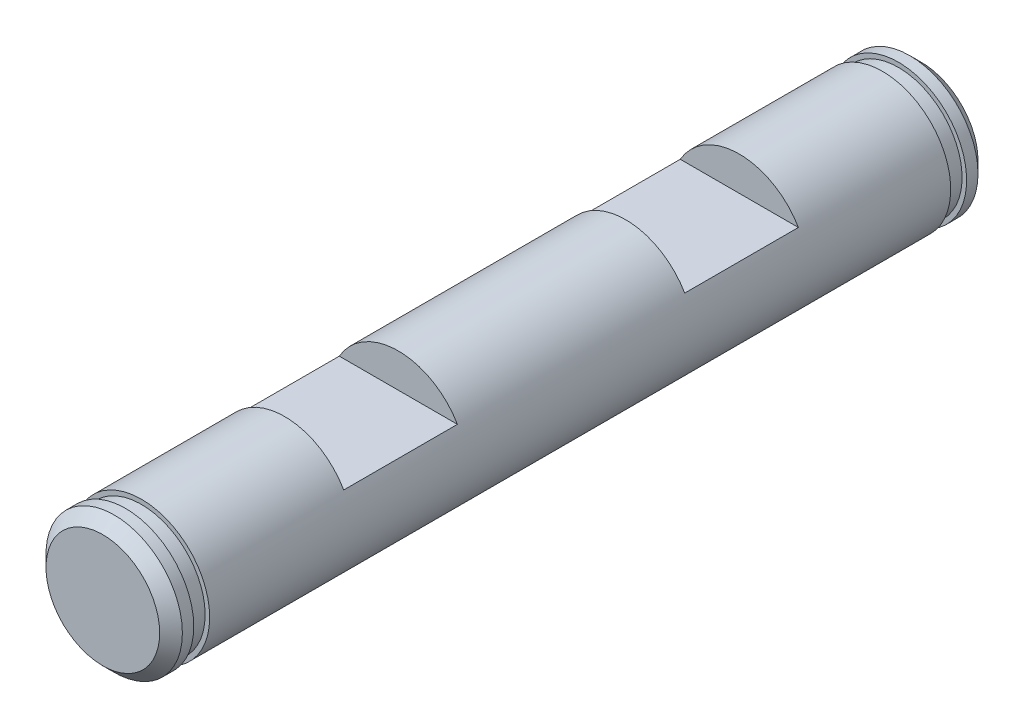
from build123d import *

# Parameters (mm, degrees)
SZKIC1_R                    = 3
DODANIE_WYCI_GNI_CIE1_DEPTH = 36
SFAZOWANIE1_SIZE            = 0.5
WYTNIJ_WYCI_GNI_CIE1_START  = -1.7
SZKIC2_R                    = 3
SZKIC2_R_2                  = 2.8
WYTNIJ_WYCI_GNI_CIE1_DEPTH  = 0.7
WYTNIJ_WYCI_GNI_CIE2_START  = -1
SZKIC3_R                    = 3
SZKIC3_R_2                  = 2.8
WYTNIJ_WYCI_GNI_CIE2_DEPTH  = 0.7
WYTNIJ_WYCI_GNI_CIE3_START  = -13
WYTNIJ_WYCI_GNI_CIE3_DEPTH  = 5
WYTNIJ_WYCI_GNI_CIE4_START  = -28
WYTNIJ_WYCI_GNI_CIE4_DEPTH  = 5


with BuildPart() as part:
    # Szkic1 → Dodanie-wyciągnięcie1 (new body)
    with BuildSketch(Plane.XY):
        Circle(SZKIC1_R)
    extrude(amount=DODANIE_WYCI_GNI_CIE1_DEPTH)

    # Sfazowanie1
    sfazowanie1_edges = [part.edges().sort_by_distance(p)[0] for p in [
        (-3, 0, 0),
        (-3, 0, 36),
    ]]
    chamfer(sfazowanie1_edges, length=SFAZOWANIE1_SIZE)

    # Szkic2 → Wytnij-wyciągnięcie1 (cut)
    with BuildSketch(Plane.XY.offset(36).offset(WYTNIJ_WYCI_GNI_CIE1_START)):
        Circle(SZKIC2_R)
        Circle(SZKIC2_R_2, mode=Mode.SUBTRACT)
    extrude(amount=WYTNIJ_WYCI_GNI_CIE1_DEPTH, mode=Mode.SUBTRACT)

    # Szkic3 → Wytnij-wyciągnięcie2 (cut)
    with BuildSketch(Plane(origin=(0, 0, 0), x_dir=(-1, 0, 0), z_dir=(0, 0, -1)).offset(WYTNIJ_WYCI_GNI_CIE2_START)):
        Circle(SZKIC3_R)
        Circle(SZKIC3_R_2, mode=Mode.SUBTRACT)
    extrude(amount=-WYTNIJ_WYCI_GNI_CIE2_DEPTH, mode=Mode.SUBTRACT)

    # Szkic4 → Wytnij-wyciągnięcie3 (cut)
    with BuildSketch(Plane.XY.offset(36).offset(WYTNIJ_WYCI_GNI_CIE3_START)):
        with BuildLine():
            Line((-2.598076211, 1.5), (2.598076211, 1.5))
            ThreePointArc((2.598076211, 1.5), (0, 3), (-2.598076211, 1.5))
        make_face()
    extrude(amount=WYTNIJ_WYCI_GNI_CIE3_DEPTH, mode=Mode.SUBTRACT)

    # Szkic4<2> → Wytnij-wyciągnięcie4 (cut)
    with BuildSketch(Plane.XY.offset(36).offset(WYTNIJ_WYCI_GNI_CIE4_START)):
        with BuildLine():
            Line((-2.598076211, 1.5), (2.598076211, 1.5))
            ThreePointArc((2.598076211, 1.5), (0, 3), (-2.598076211, 1.5))
        make_face()
    extrude(amount=WYTNIJ_WYCI_GNI_CIE4_DEPTH, mode=Mode.SUBTRACT)


solid = part.part
